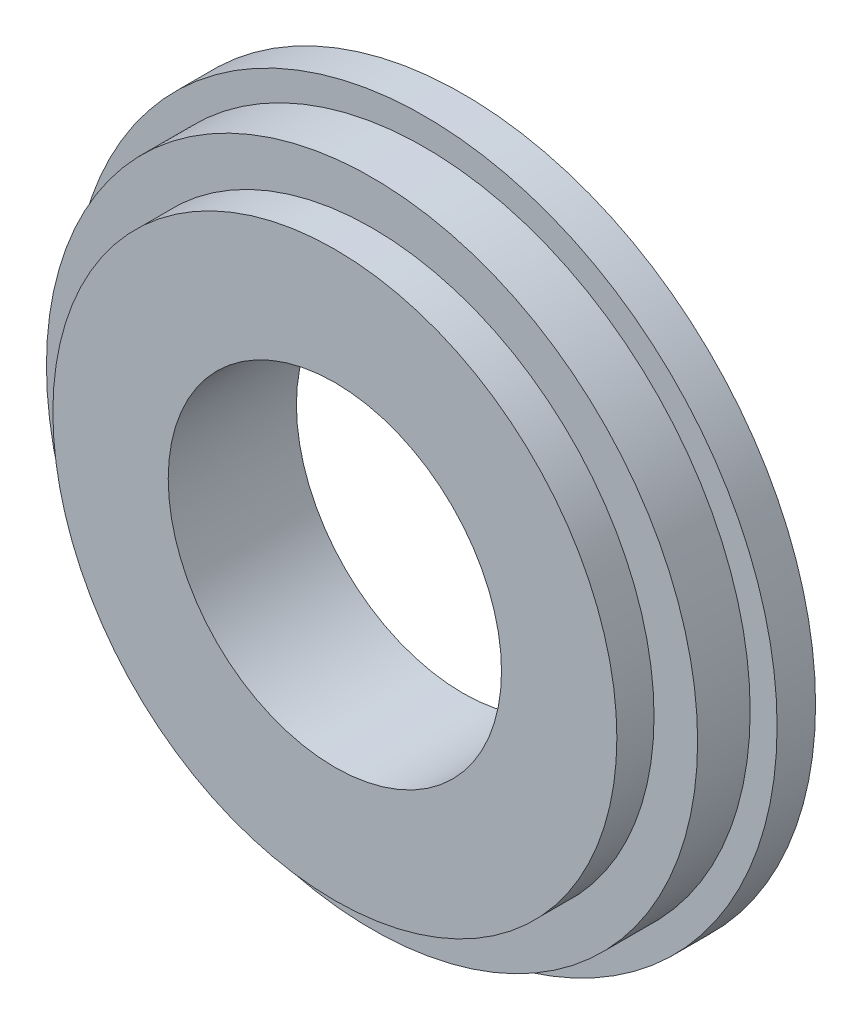
from build123d import *

# Parameters (mm, degrees)
SKETCH_1_R          = 27.5
EXTRUDE_1_DEPTH     = 3
SKETCH_1_3_R        = 25.4
EXTRUDE_2_DEPTH     = 7.1
SKETCH_1_4_R        = 22
EXTRUDE_3_DEPTH     = 10
SKETCH_1_5_R        = 13
CUT_EXTRUDE_1_DEPTH = 10


with BuildPart() as part:
    # 草图1 → 凸台-拉伸1 (new body)
    with BuildSketch(Plane.XY):
        Circle(SKETCH_1_R)
    extrude(amount=EXTRUDE_1_DEPTH)

    # 草图1<3> → 凸台-拉伸2 (add)
    with BuildSketch(Plane.XY):
        Circle(SKETCH_1_3_R)
    extrude(amount=EXTRUDE_2_DEPTH)

    # 草图1<4> → 凸台-拉伸3 (add)
    with BuildSketch(Plane.XY):
        Circle(SKETCH_1_4_R)
    extrude(amount=EXTRUDE_3_DEPTH)

    # 草图1<5> → 切除-拉伸1 (cut)
    with BuildSketch(Plane.XY):
        Circle(SKETCH_1_5_R)
    extrude(amount=CUT_EXTRUDE_1_DEPTH, mode=Mode.SUBTRACT)


solid = part.part
